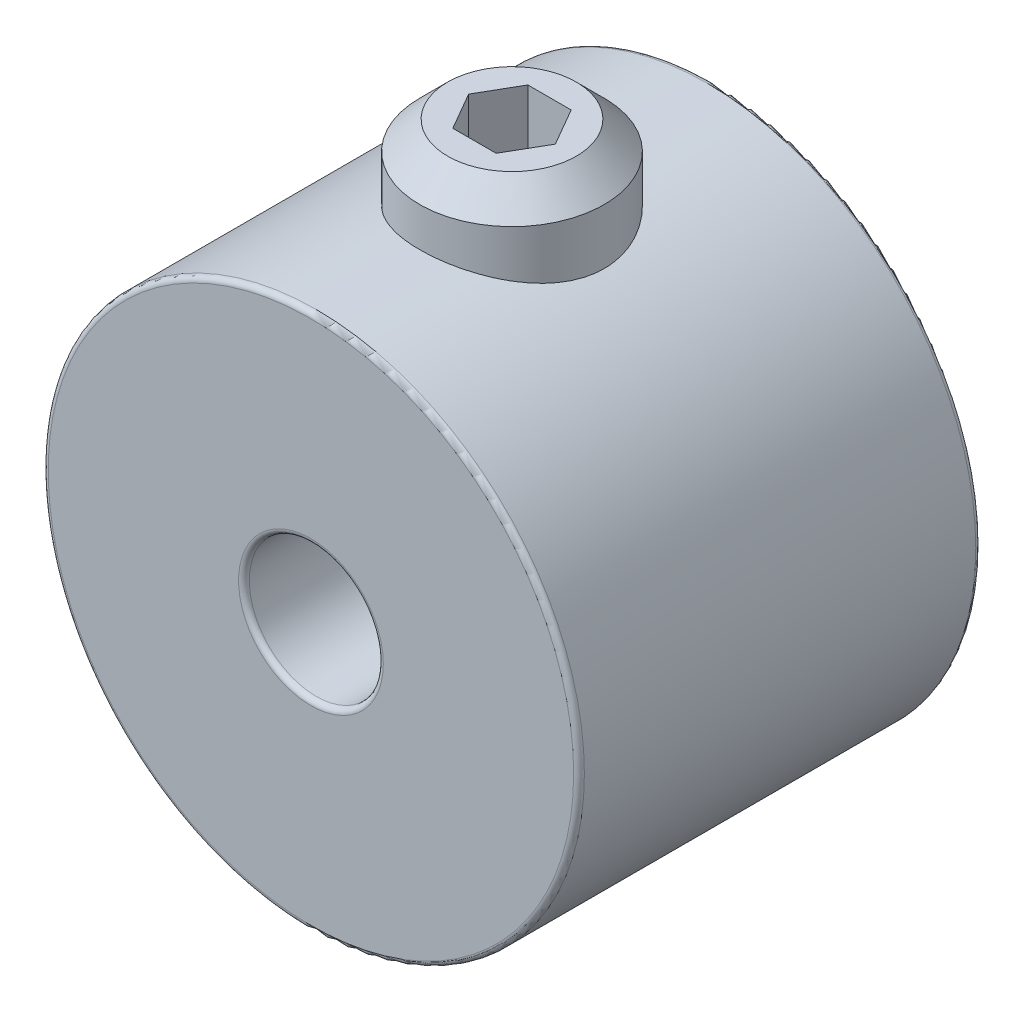
from build123d import *

# Parameters (mm, degrees)
SKETCH1_R          = 3.175
SKETCH1_R_2        = 0.79375
EXTRUDE1_DEPTH     = 2.38125
SKETCH2_R          = 1.0922
CUT_EXTRUDE1_DEPTH = 45.62682463
FILLET1_R          = 0.0635
CUT_EXTRUDE2_DEPTH = 0.889


with BuildPart() as part:
    # Sketch1 → Extrude1 (new, symmetric)
    with BuildSketch(Plane.XY):
        with Locations(Location((0, 0, 0), (0, 0, 180))):
            Circle(SKETCH1_R)
        with Locations(Location((0, 0, 0), (0, 0, 180))):
            Circle(SKETCH1_R_2, mode=Mode.SUBTRACT)
    extrude(amount=EXTRUDE1_DEPTH, both=True)

    # Sketch2 → Cut-Extrude1 (cut, through all)
    with BuildSketch(Plane(origin=(41.275, 0, 0), x_dir=(0, 0, -1), z_dir=(0, -1, 0))):
        with Locations((0, -41.275)):
            Circle(SKETCH2_R)
    extrude(amount=-CUT_EXTRUDE1_DEPTH, mode=Mode.SUBTRACT)

    # Fillet1
    fillet1_edges = [part.edges().sort_by_distance(p)[0] for p in [
        (3.175, 0, -2.38125),
        (3.175, 0, 2.38125),
        (0.79375, 0, -2.38125),
        (0.79375, 0, 2.38125),
    ]]
    fillet(fillet1_edges, radius=FILLET1_R)


with BuildPart() as body_2:
    # Sketch3 → Revolve1 (revolve)
    with BuildSketch(Plane.XY):
        Polygon((-0.761379651, 0.79375), (-0.396984419, 0.79375), (0, 1.190734419), (0, 3.96875), (-0.761379651, 3.96875), (-1.0922, 3.637929651), (-1.0922, 1.124570349), align=None)
    revolve(axis=Axis((0, 0.79375, 0), (0, -1, 0)))

    # Sketch4 → Cut-Extrude2 (cut)
    with BuildSketch(Plane(origin=(3.3734375, 3.96875, 0), x_dir=(0, 0, -1), z_dir=(0, -1, 0))):
        Polygon((0, -2.860173111), (-0.4445, -3.116805305), (-0.4445, -3.630069695), (0, -3.886701889), (0.4445, -3.630069695), (0.4445, -3.116805305), align=None)
    extrude(amount=CUT_EXTRUDE2_DEPTH, mode=Mode.SUBTRACT)


solid = Compound([part.part, body_2.part])
